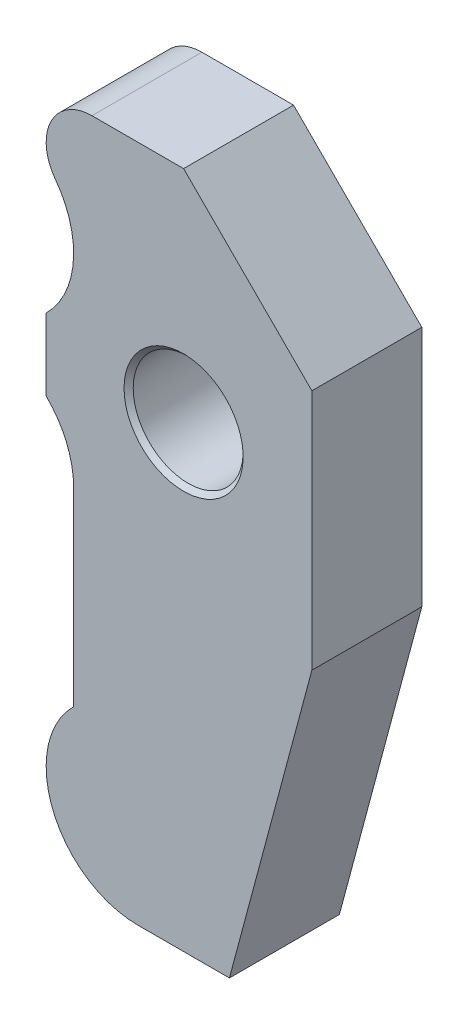
from build123d import *

# Parameters (mm, degrees)
SKETCH_1_R      = 6
EXTRUDE_1_DEPTH = 6
CHAMFER_1_SIZE  = 0.5


with BuildPart() as part:
    # Эскиз1 → Бобышка-Вытянуть1 (new, symmetric)
    with BuildSketch(Plane.XY):
        with BuildLine():
            Line((0, 24), (14, 10))
            Line((14, 10), (14, -16.411542732))
            Line((14, -16.411542732), (5, -50))
            Line((5, -50), (-5, -50))
            ThreePointArc((-5, -50), (-14.257815193, -43.780589618), (-12, -32.858571571))
            Line((-12, -32.858571571), (-12, -12.141428429))
            ThreePointArc((-12, -12.141428429), (-12.780455543, -8.268445082), (-15, -5))
            Line((-15, -5), (-15, 2.858571571))
            ThreePointArc((-15, 2.858571571), (-12.028827286, 9.241241333), (-14, 16))
            ThreePointArc((-14, 16), (-14.472135955, 21.236067977), (-10, 24))
            Line((-10, 24), (0, 24))
        make_face()
        Circle(SKETCH_1_R, mode=Mode.SUBTRACT)
    extrude(amount=EXTRUDE_1_DEPTH, both=True)

    # Фаска1
    chamfer_1_edges = [part.edges().sort_by_distance(p)[0] for p in [
        (-6, 0, -6),
        (-6, 0, 6),
    ]]
    chamfer(chamfer_1_edges, length=CHAMFER_1_SIZE)


solid = part.part
